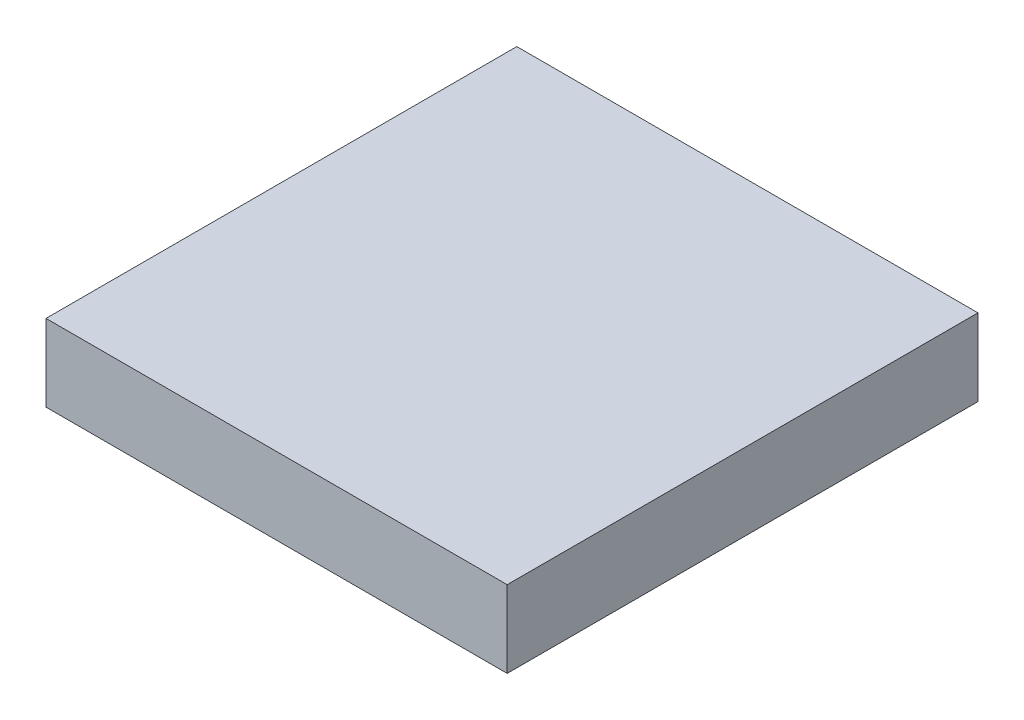
from build123d import *

# Parameters (mm, degrees)
SKETCH_1_W          = 120
SKETCH_1_H          = 122.5
EXTRUDE_1_DEPTH     = 20
SKETCH_2_W          = 118
SKETCH_2_H          = 120.5
CUT_EXTRUDE_1_DEPTH = 19


with BuildPart() as part:
    # 草图1 → 凸台-拉伸1 (new body)
    with BuildSketch(Plane(origin=(0, 0, 0), x_dir=(1, 0, 0), z_dir=(0, 1, 0))):
        with Locations((60, 61.25)):
            Rectangle(SKETCH_1_W, SKETCH_1_H)
    extrude(amount=EXTRUDE_1_DEPTH)

    # 草图2 → 切除-拉伸1 (cut)
    with BuildSketch(Plane.XZ):
        with Locations((60, -61.25)):
            Rectangle(SKETCH_2_W, SKETCH_2_H)
    extrude(amount=-CUT_EXTRUDE_1_DEPTH, mode=Mode.SUBTRACT)


solid = part.part
